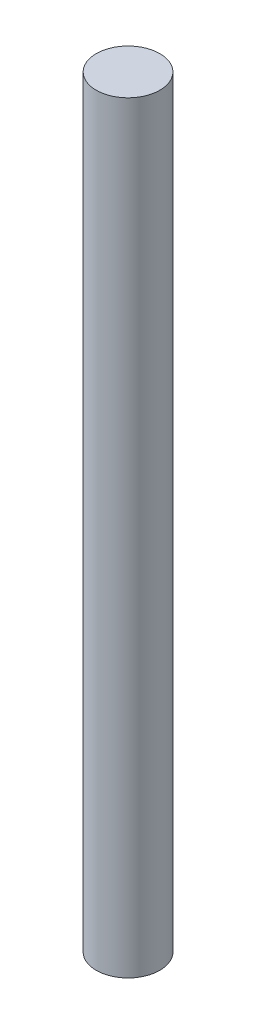
from build123d import *

# Parameters (mm, degrees)
SKETCH1_W = 6.35
SKETCH1_H = 152.4


with BuildPart() as part:
    # Sketch1 → Revolve1 (revolve)
    with BuildSketch(Plane.XY, mode=Mode.PRIVATE) as revolve1_sk:
        with Locations((3.175, 76.2)):
            Rectangle(SKETCH1_W, SKETCH1_H)
    revolve(revolve1_sk.sketch.rotate(Axis((0, 0, 0), (0, 1, 0)), 90), axis=Axis((0, 0, 0), (0, 1, 0)))


solid = part.part
